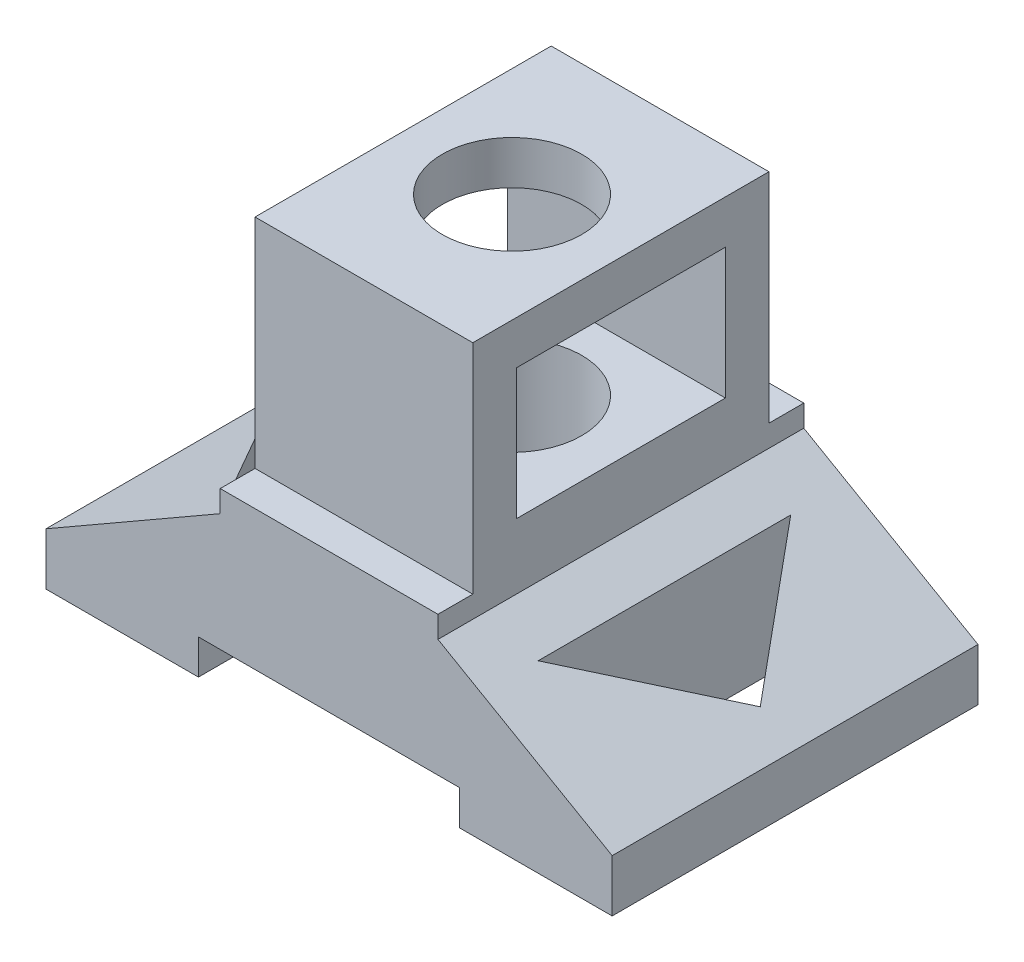
from build123d import *

# Parameters (mm, degrees)
BOSS_EXTRUDE1_DEPTH      = 42
BOSS_EXTRUDE1_DEPTH_BACK = 42
BOSS_EXTRUDE2_DEPTH      = 34
BOSS_EXTRUDE2_DEPTH_BACK = 34
SKETCH1_3_W              = 50
SKETCH1_3_H              = 50
SKETCH2_W                = 48
SKETCH2_H                = 30
CUT_EXTRUDE1_DEPTH       = 135.029847422
SKETCH3_R                = 16
CUT_EXTRUDE2_DEPTH       = 119.697093477


with BuildPart() as part:
    # Sketch1 → Boss-Extrude1 (new, two sides: drawn at the far end of the back side and taken through both)
    with BuildSketch(Plane.XY.offset(-BOSS_EXTRUDE1_DEPTH_BACK)):
        Polygon((-30, 0), (-30, 8), (30, 8), (30, 0), (65, 0), (65, 12), (25, 35), (25, 40), (-25, 40), (-25, 35), (-65, 12), (-65, 0), align=None)
    extrude(amount=BOSS_EXTRUDE1_DEPTH + BOSS_EXTRUDE1_DEPTH_BACK)

    # Sketch1<3> → Boss-Extrude2 (add, two sides: drawn at the far end of the back side and taken through both)
    with BuildSketch(Plane.XY.offset(-BOSS_EXTRUDE2_DEPTH_BACK)):
        with Locations((0, 65)):
            Rectangle(SKETCH1_3_W, SKETCH1_3_H)
    extrude(amount=BOSS_EXTRUDE2_DEPTH + BOSS_EXTRUDE2_DEPTH_BACK)

    # Sketch2 → Cut-Extrude1 (cut, through all)
    with BuildSketch(Plane(origin=(25, 0, 0), x_dir=(0, 0, -1), z_dir=(1, 0, 0))):
        with Locations((0, 65)):
            Rectangle(SKETCH2_W, SKETCH2_H)
    extrude(amount=-CUT_EXTRUDE1_DEPTH, mode=Mode.SUBTRACT)

    # Sketch3 → Cut-Extrude2 (cut, through all)
    with BuildSketch(Plane.XZ):
        Circle(SKETCH3_R)
        Polygon((-35, 29), (-57, 0), (-35, -29), align=None)
        Polygon((35, -29), (35, 29), (57, 0), align=None)
    extrude(amount=-CUT_EXTRUDE2_DEPTH, mode=Mode.SUBTRACT)


solid = part.part
